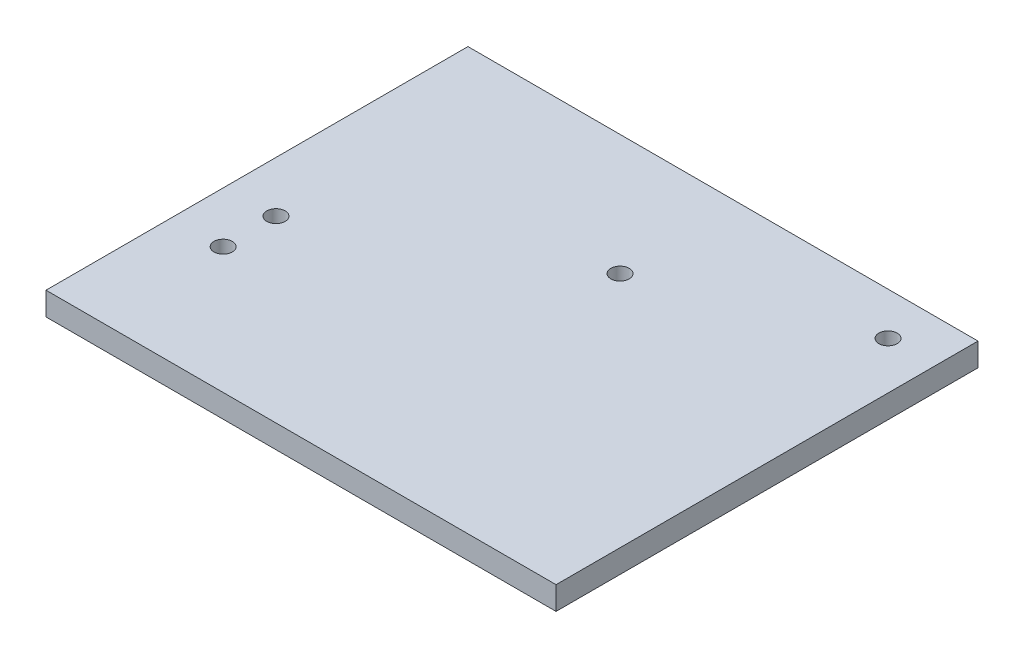
from build123d import *

# Parameters (mm, degrees)
SKETCH1_W           = 110
SKETCH1_H           = 91
SKETCH1_R           = 1.98
BOSS_EXTRUDE1_DEPTH = 5


with BuildPart() as part:
    # Sketch1 → Boss-Extrude1 (new body)
    with BuildSketch(Plane(origin=(0, 0, 0), x_dir=(1, 0, 0), z_dir=(0, 1, 0))):
        Rectangle(SKETCH1_W, SKETCH1_H)
        with Locations((-44.025, -18.275)):
            Circle(SKETCH1_R, mode=Mode.SUBTRACT)
        with Locations((-44.025, -6.875)):
            Circle(SKETCH1_R, mode=Mode.SUBTRACT)
        with Locations((3.8, 19.5)):
            Circle(SKETCH1_R, mode=Mode.SUBTRACT)
        with BuildLine():
            ThreePointArc((46.78, 36.3), (45.465452324, 34.435174752), (43.267299794, 35.046512833))
            ThreePointArc((43.267299794, 35.046512833), (43.553744952, 37.838586479), (46.344438628, 37.538995289))
            ThreePointArc((46.344438628, 37.538995289), (46.6679385, 36.956662591), (46.78, 36.3))
        make_face(mode=Mode.SUBTRACT)
    extrude(amount=BOSS_EXTRUDE1_DEPTH)


solid = part.part
